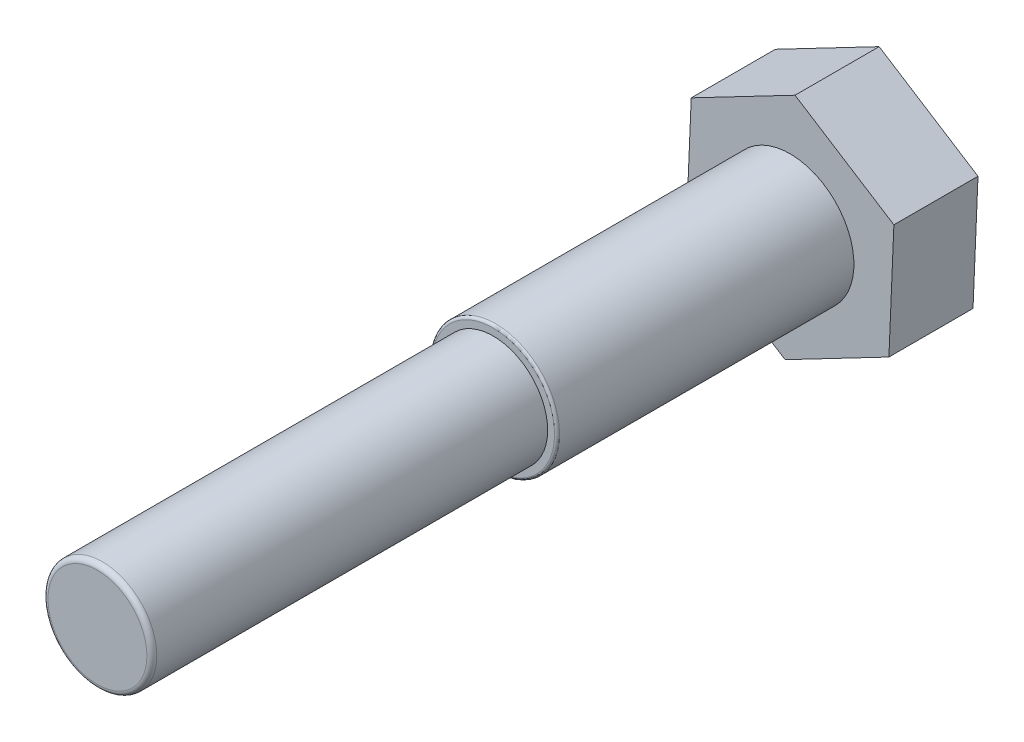
from build123d import *

# Parameters (mm, degrees)
EXTRUDE_276_DEPTH = 17
SKETCH_2_R        = 12.9
EXTRUDE_1_DEPTH   = 60
SKETCH_3_R        = 11
EXTRUDE_2_DEPTH   = 80
FILLET_2_R        = 1
FILLET_4_R        = 0.5


with BuildPart() as part:
    # 草图1 → Extrude 276 (new body)
    with BuildSketch(Plane.XY):
        Polygon((20.984201837, 10.954296262), (1.005402075, 23.65), (-19.978799762, 12.695703738), (-20.984201837, -10.954296262), (-1.005402075, -23.65), (19.978799762, -12.695703738), align=None)
    extrude(amount=EXTRUDE_276_DEPTH)

    # 草图2 → 凸台-拉伸1 (add)
    with BuildSketch(Plane.XY.offset(17)):
        with Locations(Location((0, 0, 0), (0, 0, 180))):
            Circle(SKETCH_2_R)
    extrude(amount=EXTRUDE_1_DEPTH)

    # 草图3 → 凸台-拉伸2 (add)
    with BuildSketch(Plane.XY.offset(77)):
        Circle(SKETCH_3_R)
    extrude(amount=EXTRUDE_2_DEPTH)

    # 圆角2
    fillet_2_edges = [part.edges().sort_by_distance(p)[0] for p in [
        (-11, 0, 157),
    ]]
    fillet(fillet_2_edges, radius=FILLET_2_R)

    # 圆角4
    fillet_4_edges = [part.edges().sort_by_distance(p)[0] for p in [
        (12.9, 0, 77),
    ]]
    fillet(fillet_4_edges, radius=FILLET_4_R)


solid = part.part
